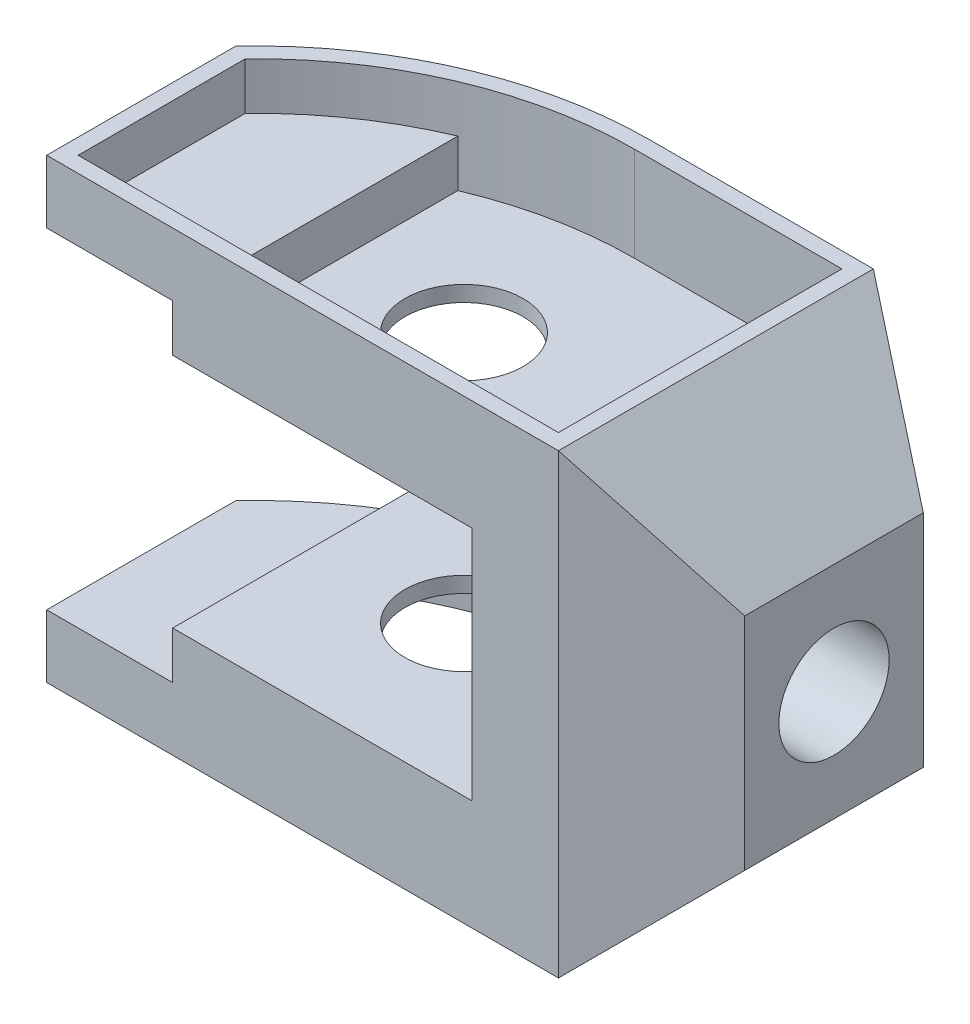
from build123d import *

# Parameters (mm, degrees)
SKETCH1_R           = 7.5
BOSS_EXTRUDE1_DEPTH = 58
CUT_EXTRUDE1_DEPTH  = 107.60206377
SKETCH5_R           = 7
CUT_EXTRUDE2_DEPTH  = 107.60206377
CUT_EXTRUDE3_DEPTH  = 107.60206377
CUT_EXTRUDE4_DEPTH  = 6
CUT_EXTRUDE6_DEPTH  = 6
CUT_EXTRUDE8_START  = -6
CUT_EXTRUDE8_DEPTH  = 6
SKETCH10_4_R        = 7.5
CUT_EXTRUDE9_DEPTH  = 12


with BuildPart() as part:
    # Sketch1 → Boss-Extrude1 (new body)
    with BuildSketch(Plane(origin=(0, 0, 0), x_dir=(1, 0, 0), z_dir=(0, 1, 0))):
        with BuildLine():
            Line((0, 0), (65, 0))
            Line((65, 0), (80, 8.660254038))
            Line((80, 8.660254038), (80, 31.339745962))
            Line((80, 31.339745962), (65, 40))
            Line((65, 40), (36.66060556, 40))
            ThreePointArc((36.66060556, 40), (16.66060556, 35.82575695), (0, 24))
            Line((0, 24), (0, 0))
        make_face()
        with Locations((34, 19)):
            Circle(SKETCH1_R, mode=Mode.SUBTRACT)
    extrude(amount=BOSS_EXTRUDE1_DEPTH)

    # Sketch4 → Cut-Extrude1 (cut, through all)
    with BuildSketch(Plane(origin=(0, 0, -40), x_dir=(-1, 0, 0), z_dir=(0, 0, -1))):
        Polygon((-16, 50), (-16, 44), (-54, 44), (-54, 14), (-16, 14), (-16, 8), (0, 8), (0, 50), align=None)
    extrude(amount=-CUT_EXTRUDE1_DEPTH, mode=Mode.SUBTRACT)

    # Sketch5 → Cut-Extrude2 (cut, through all)
    with BuildSketch(Plane(origin=(80, 0, 0), x_dir=(0, 0, -1), z_dir=(1, 0, 0))):
        with Locations((20, 29)):
            Circle(SKETCH5_R)
    extrude(amount=-CUT_EXTRUDE2_DEPTH, mode=Mode.SUBTRACT)

    # Sketch7 → Cut-Extrude3 (cut, through all)
    with BuildSketch(Plane(origin=(0, 0, -40), x_dir=(-1, 0, 0), z_dir=(0, 0, -1))):
        Polygon((-80, 58), (-80, 43), (-65, 58), align=None)
        Polygon((-80, 0), (-80, 15), (-65, 0), align=None)
    extrude(amount=-CUT_EXTRUDE3_DEPTH, mode=Mode.SUBTRACT)

    # Sketch8 → Cut-Extrude4 (cut)
    with BuildSketch(Plane(origin=(0, 58, 0), x_dir=(1, 0, 0), z_dir=(0, 1, 0))):
        with BuildLine():
            Line((63, 2), (63, 38))
            Line((63, 38), (36.66060556, 38))
            ThreePointArc((36.66060556, 38), (17.817714076, 34.146862182), (2, 23.206060023))
            Line((2, 23.206060023), (2, 2))
            Line((2, 2), (63, 2))
        make_face()
    extrude(amount=-CUT_EXTRUDE4_DEPTH, mode=Mode.SUBTRACT)

    # Sketch9 → Cut-Extrude6 (cut)
    with BuildSketch(Plane(origin=(0, 52, 0), x_dir=(1, 0, 0), z_dir=(0, 1, 0))):
        with BuildLine():
            Line((18, 2), (18, 34.224221872))
            ThreePointArc((18, 34.224221872), (27.141221384, 37.046586751), (36.66060556, 38))
            Line((36.66060556, 38), (63, 38))
            Line((63, 38), (63, 2))
            Line((63, 2), (18, 2))
        make_face()
    extrude(amount=-CUT_EXTRUDE6_DEPTH, mode=Mode.SUBTRACT)

    # Sketch10 → Cut-Extrude8 (cut)
    with BuildSketch(Plane.XZ.offset(CUT_EXTRUDE8_START)):
        with BuildLine():
            Line((18, -34.224221872), (18, -2))
            Line((18, -2), (2, -2))
            Line((2, -2), (2, -23.206060023))
            ThreePointArc((2, -23.206060023), (9.436758267, -29.533051217), (18, -34.224221872))
        make_face()
    extrude(amount=CUT_EXTRUDE8_DEPTH, mode=Mode.SUBTRACT)

    # Sketch10<4> → Cut-Extrude9 (cut)
    with BuildSketch(Plane.XZ):
        with BuildLine():
            Line((63, -2), (18, -2))
            Line((18, -2), (18, -34.224221872))
            ThreePointArc((18, -34.224221872), (27.141221384, -37.046586751), (36.66060556, -38))
            Line((36.66060556, -38), (63, -38))
            Line((63, -38), (63, -2))
        make_face()
        with Locations((34, -19)):
            Circle(SKETCH10_4_R, mode=Mode.SUBTRACT)
    extrude(amount=-CUT_EXTRUDE9_DEPTH, mode=Mode.SUBTRACT)


solid = part.part
